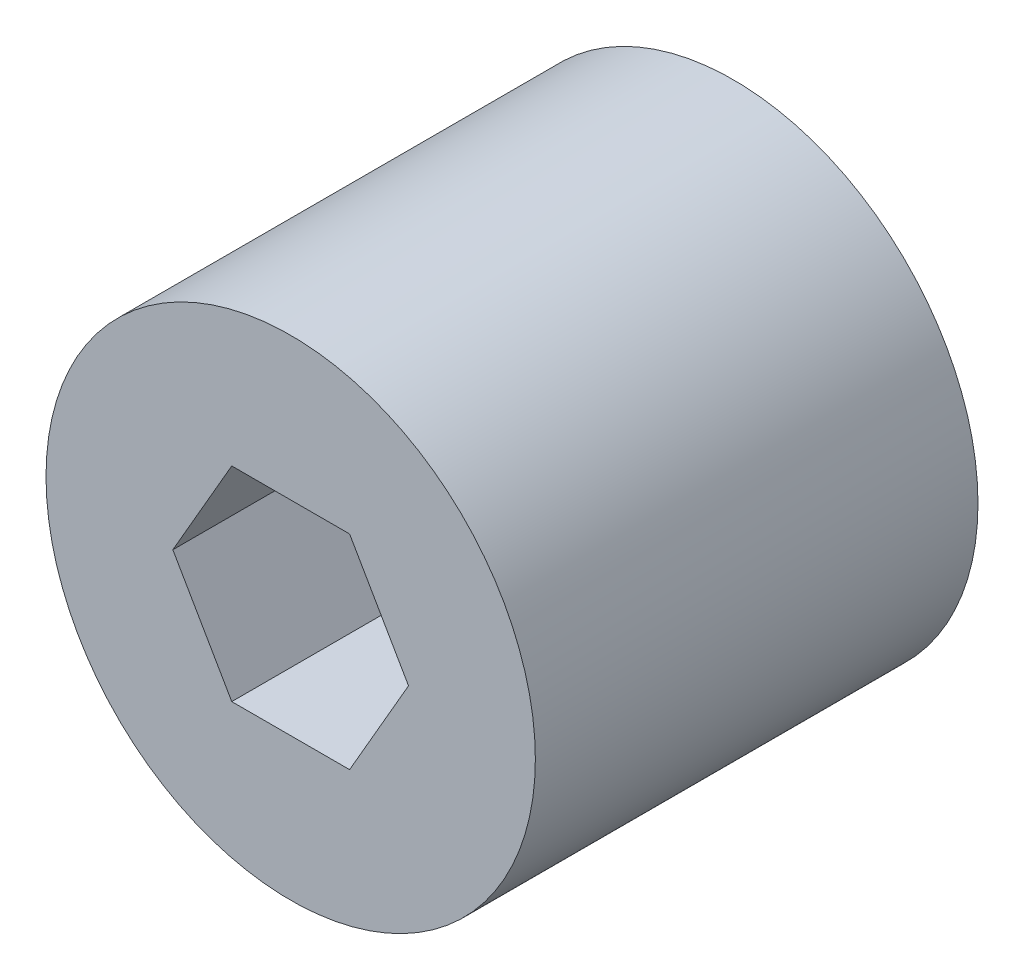
from build123d import *

# Parameters (mm, degrees)
SKETCH_1_R          = 4.975
EXTRUDE_1_DEPTH     = 9
CUT_EXTRUDE_1_DEPTH = 7.5


with BuildPart() as part:
    # 草图1 → 凸台-拉伸1 (new body)
    with BuildSketch(Plane.XY):
        Circle(SKETCH_1_R)
    extrude(amount=EXTRUDE_1_DEPTH)

    # 草图2 → 切除-拉伸1 (cut)
    with BuildSketch(Plane.XY.offset(9)):
        Polygon((2.396003617, 0), (1.198001809, 2.075), (-1.198001809, 2.075), (-2.396003617, 0), (-1.198001809, -2.075), (1.198001809, -2.075), align=None)
    extrude(amount=-CUT_EXTRUDE_1_DEPTH, mode=Mode.SUBTRACT)


solid = part.part
